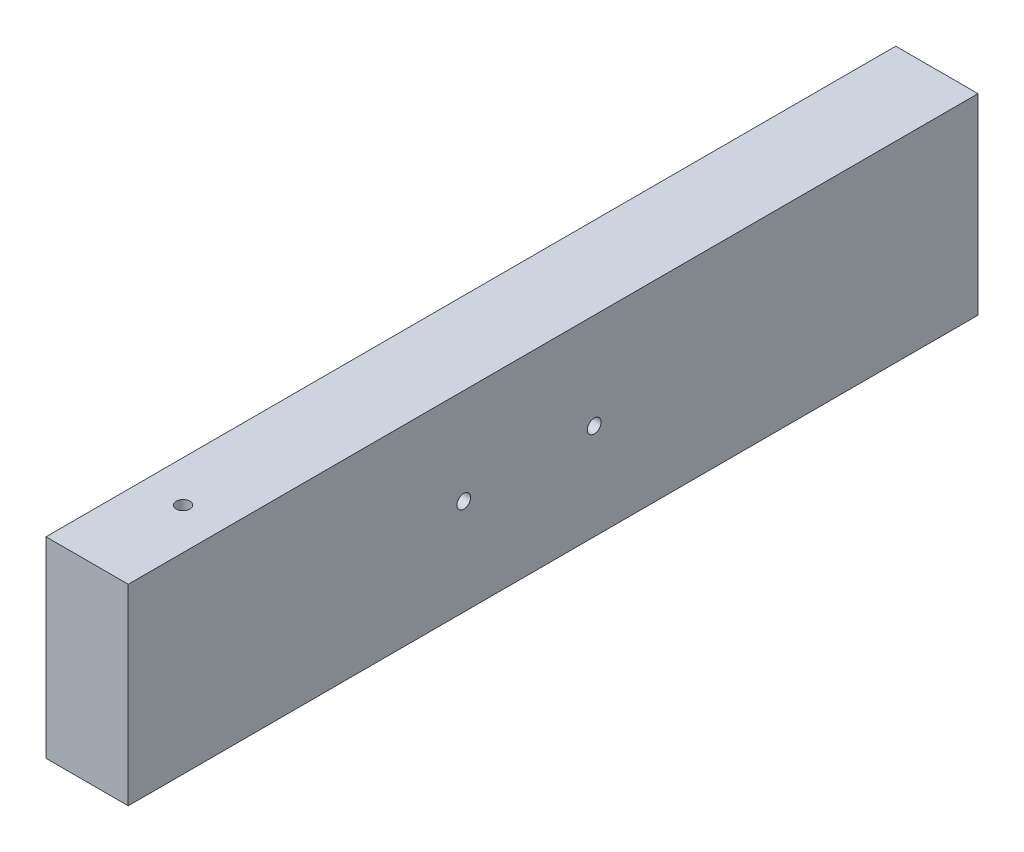
from build123d import *

# Parameters (mm, degrees)
SKETCH1_W           = 38.1
SKETCH1_H           = 393.7
BOSS_EXTRUDE1_DEPTH = 88.9
SKETCH3_R           = 3.175
CUT_EXTRUDE2_DEPTH  = 337.964070937
SKETCH2_R           = 3.175
CUT_EXTRUDE3_DEPTH  = 365.806065952


with BuildPart() as part:
    # Sketch1 → Boss-Extrude1 (new body)
    with BuildSketch(Plane(origin=(0, 0, 0), x_dir=(1, 0, 0), z_dir=(0, 1, 0))):
        with Locations((-125.830263158, 125.934703947)):
            Rectangle(SKETCH1_W, SKETCH1_H)
    extrude(amount=BOSS_EXTRUDE1_DEPTH)

    # Sketch3 → Cut-Extrude2 (cut, through all)
    with BuildSketch(Plane.ZY.offset(144.880263158)):
        with Locations((-84.532703947, 44.45)):
            Circle(SKETCH3_R)
        with Locations((-144.984703947, 44.45)):
            Circle(SKETCH3_R)
    extrude(amount=-CUT_EXTRUDE2_DEPTH, mode=Mode.SUBTRACT)

    # Sketch2 → Cut-Extrude3 (cut, through all)
    with BuildSketch(Plane(origin=(0, 0, 0), x_dir=(-1, 0, 0), z_dir=(0, -1, 0))):
        with Locations(Location((125.830263158, -26.465296053, 0), (0, 0, 90))):
            Circle(SKETCH2_R)
    extrude(amount=-CUT_EXTRUDE3_DEPTH, mode=Mode.SUBTRACT)


solid = part.part
